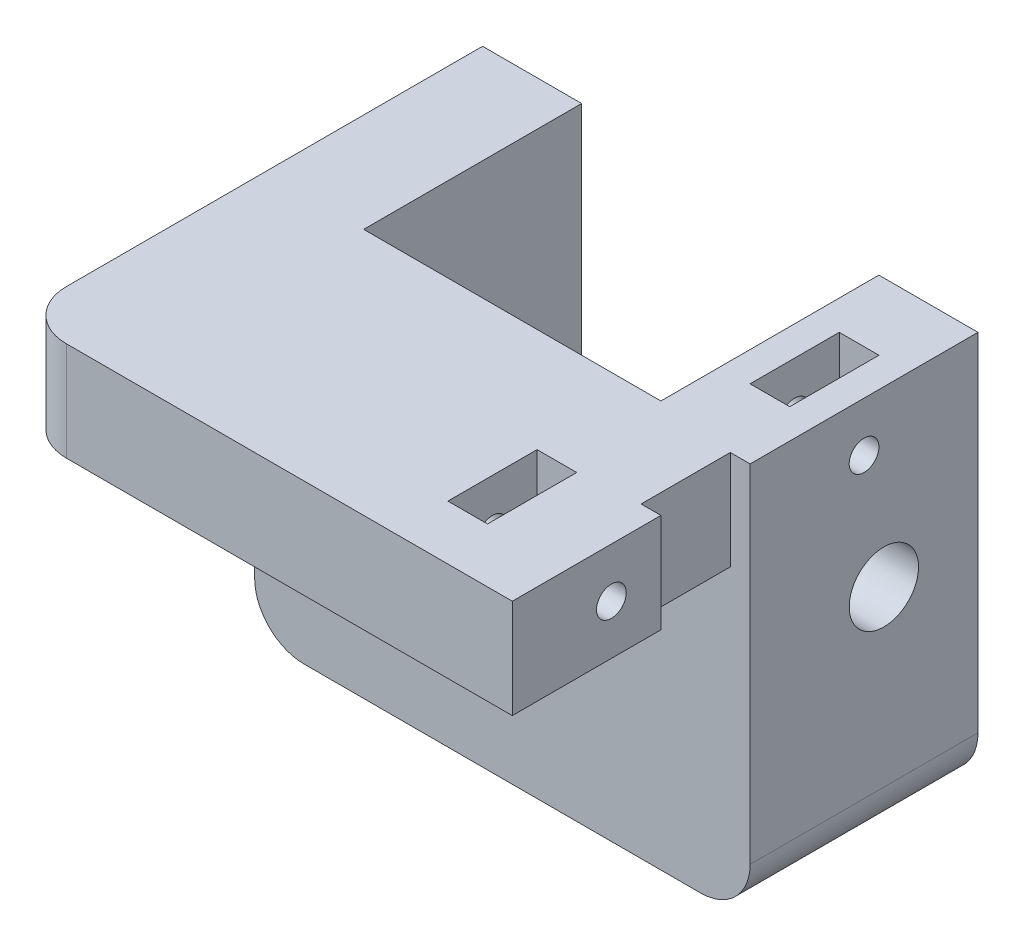
from build123d import *

# Parameters (mm, degrees)
BOSS_EXTRUDE1_DEPTH = 22
SKETCH3_W           = 10
SKETCH3_H           = 10
BOSS_EXTRUDE2_DEPTH = 25
SKETCH4_W           = 25
SKETCH4_H           = 10
BOSS_EXTRUDE3_DEPTH = 40
SKETCH5_W           = 2
SKETCH5_H           = 10
CUT_EXTRUDE4_DEPTH  = 40
BOSS_EXTRUDE4_DEPTH = 1
SKETCH7_R           = 1.5
CUT_EXTRUDE5_DEPTH  = 15
SKETCH8_W           = 4
SKETCH8_H           = 9
CUT_EXTRUDE6_DEPTH  = 15
FILLET1_R           = 5
FILLET2_R           = 5
FILLET3_R           = 5
SKETCH9_R           = 3.5
CUT_EXTRUDE7_DEPTH  = 1000
SKETCH10_W          = 4
SKETCH10_H          = 9
BOSS_EXTRUDE5_DEPTH = 15
SKETCH11_R          = 1.5
BOSS_EXTRUDE6_DEPTH = 10
SKETCH12_R          = 1.5
CUT_EXTRUDE8_DEPTH  = 19
SKETCH13_W          = 4.004831452
SKETCH13_H          = 9
CUT_EXTRUDE9_DEPTH  = 10


with BuildPart() as part:
    # Sketch1 → Boss-Extrude1 (new body)
    with BuildSketch(Plane.XY):
        Polygon((0, 30), (-10, 30), (-10, -10), (40, -10), (40, 30), (30, 30), (30, 0), (0, 0), align=None)
    extrude(amount=BOSS_EXTRUDE1_DEPTH)

    # Sketch3 → Boss-Extrude2 (add)
    with BuildSketch(Plane.XY.offset(22)):
        with Locations((-5, 25)):
            Rectangle(SKETCH3_W, SKETCH3_H)
    extrude(amount=BOSS_EXTRUDE2_DEPTH)

    # Sketch4 → Boss-Extrude3 (add)
    with BuildSketch(Plane(origin=(0, 0, 0), x_dir=(0, 0, -1), z_dir=(1, 0, 0))):
        with Locations((-34.5, 25)):
            Rectangle(SKETCH4_W, SKETCH4_H)
    extrude(amount=BOSS_EXTRUDE3_DEPTH)

    # Sketch5 → Cut-Extrude4 (cut)
    with BuildSketch(Plane.XZ.offset(-20)):
        with Locations((39, 27)):
            Rectangle(SKETCH5_W, SKETCH5_H)
    extrude(amount=-CUT_EXTRUDE4_DEPTH, mode=Mode.SUBTRACT)

    # Sketch6 → Boss-Extrude4 (add)
    with BuildSketch(Plane.XY.offset(22)):
        Polygon((-10, 20), (38, 20), (38, 30), (40, 30), (40, -10), (-10, -10), align=None)
    extrude(amount=BOSS_EXTRUDE4_DEPTH)

    # Sketch7 → Cut-Extrude5 (cut)
    with BuildSketch(Plane(origin=(40, 0, 0), x_dir=(0, 0, -1), z_dir=(1, 0, 0))):
        with Locations((-37, 25)):
            Circle(SKETCH7_R)
        with Locations((-17, 25)):
            Circle(SKETCH7_R)
    extrude(amount=-CUT_EXTRUDE5_DEPTH, mode=Mode.SUBTRACT)

    # Sketch8 → Cut-Extrude6 (cut)
    with BuildSketch(Plane(origin=(0, 30, 0), x_dir=(1, 0, 0), z_dir=(0, 1, 0))):
        with Locations((35, -17)):
            Rectangle(SKETCH8_W, SKETCH8_H)
        with Locations((30, -37)):
            Rectangle(SKETCH8_W, SKETCH8_H)
    extrude(amount=-CUT_EXTRUDE6_DEPTH, mode=Mode.SUBTRACT)

    # Fillet1
    fillet1_edges = [part.edges().sort_by_distance(p)[0] for p in [
        (40, -10, 11.5),
    ]]
    fillet(fillet1_edges, radius=FILLET1_R)

    # Fillet2
    fillet2_edges = [part.edges().sort_by_distance(p)[0] for p in [
        (-10, -10, 11.5),
    ]]
    fillet(fillet2_edges, radius=FILLET2_R)

    # Fillet3
    fillet3_edges = [part.edges().sort_by_distance(p)[0] for p in [
        (-10, 25, 47),
    ]]
    fillet(fillet3_edges, radius=FILLET3_R)

    # Sketch9 → Cut-Extrude7 (cut)
    with BuildSketch(Plane(origin=(40, 0, 0), x_dir=(0, 0, -1), z_dir=(1, 0, 0))):
        with Locations((-9.5, 12.5)):
            Circle(SKETCH9_R)
    extrude(amount=-CUT_EXTRUDE7_DEPTH, mode=Mode.SUBTRACT)

    # Sketch10 → Boss-Extrude5 (add)
    with BuildSketch(Plane(origin=(0, 30, 0), x_dir=(1, 0, 0), z_dir=(0, 1, 0))):
        with Locations((35, -17)):
            Rectangle(SKETCH10_W, SKETCH10_H)
    extrude(amount=-BOSS_EXTRUDE5_DEPTH)

    # Sketch11 → Boss-Extrude6 (add)
    with BuildSketch(Plane(origin=(40, 0, 0), x_dir=(0, 0, -1), z_dir=(1, 0, 0))):
        with Locations((-17, 25)):
            Circle(SKETCH11_R)
    extrude(amount=-BOSS_EXTRUDE6_DEPTH)

    # Sketch12 → Cut-Extrude8 (cut)
    with BuildSketch(Plane(origin=(40, 0, 0), x_dir=(0, 0, -1), z_dir=(1, 0, 0))):
        with Locations((-11.5, 25)):
            Circle(SKETCH12_R)
    extrude(amount=-CUT_EXTRUDE8_DEPTH, mode=Mode.SUBTRACT)

    # Sketch13 → Cut-Extrude9 (cut)
    with BuildSketch(Plane(origin=(0, 30, 0), x_dir=(1, 0, 0), z_dir=(0, 1, 0))):
        with Locations((35, -11.5)):
            Rectangle(SKETCH13_W, SKETCH13_H)
    extrude(amount=-CUT_EXTRUDE9_DEPTH, mode=Mode.SUBTRACT)


solid = part.part
